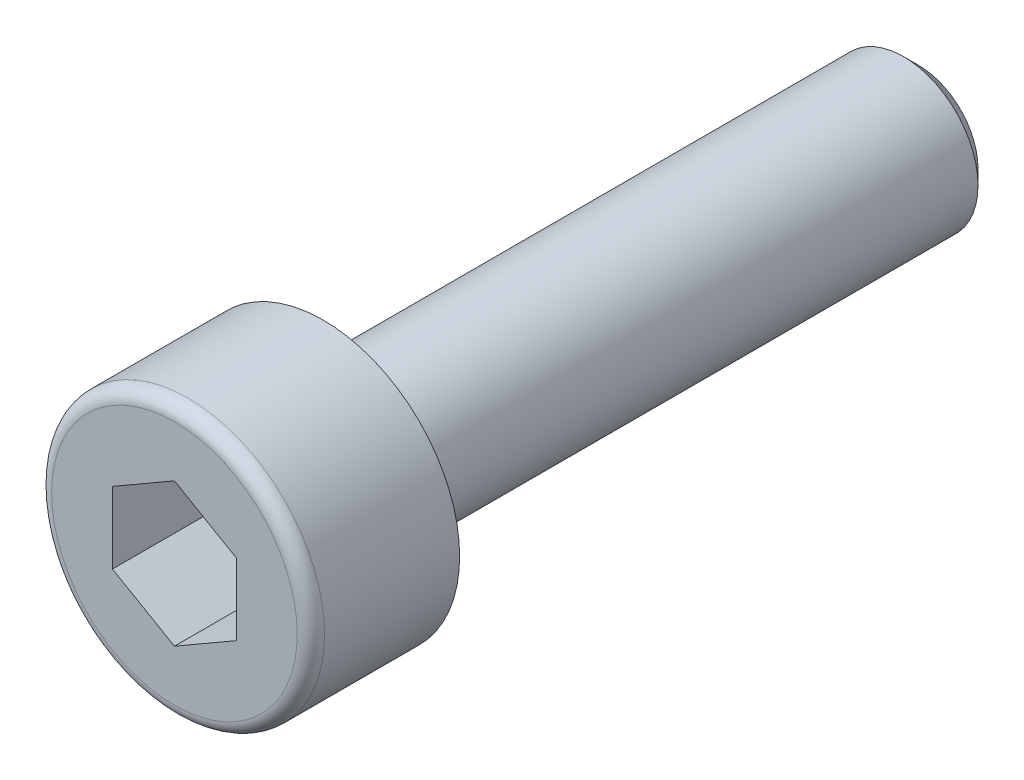
from build123d import *

# Parameters (mm, degrees)
CUT_EXTRUDE_1_DEPTH = 1.925
FILLET_1_R          = 0.275
CHAMFER_1_SIZE      = 0.3


with BuildPart() as part:
    # 草图3 → 旋转1 (revolve)
    with BuildSketch(Plane(origin=(0, 0, 0), x_dir=(0, 0, -1), z_dir=(1, 0, 0)), mode=Mode.PRIVATE) as revolve_1_sk:
        Polygon((-3, 0), (-3, 2.75), (0, 2.75), (0, 1.5), (12, 1.5), (12, 0), align=None)
    revolve(revolve_1_sk.sketch.rotate(Axis((0, 0, 3), (0, 0, -1)), 90), axis=Axis((0, 0, 3), (0, 0, -1)))

    # 草图4 → 切除-拉伸1 (cut)
    with BuildSketch(Plane.XY.offset(3)):
        Polygon((0, 1.443375673), (-1.25, 0.721687836), (-1.25, -0.721687836), (0, -1.443375673), (1.25, -0.721687836), (1.25, 0.721687836), align=None)
    extrude(amount=-CUT_EXTRUDE_1_DEPTH, mode=Mode.SUBTRACT)

    # 圆角1
    fillet_1_edges = [part.edges().sort_by_distance(p)[0] for p in [
        (-2.75, 0, 3),
    ]]
    fillet(fillet_1_edges, radius=FILLET_1_R)

    # 倒角1
    chamfer_1_edges = [part.edges().sort_by_distance(p)[0] for p in [
        (-1.5, 0, -12),
    ]]
    chamfer(chamfer_1_edges, length=CHAMFER_1_SIZE)


solid = part.part
